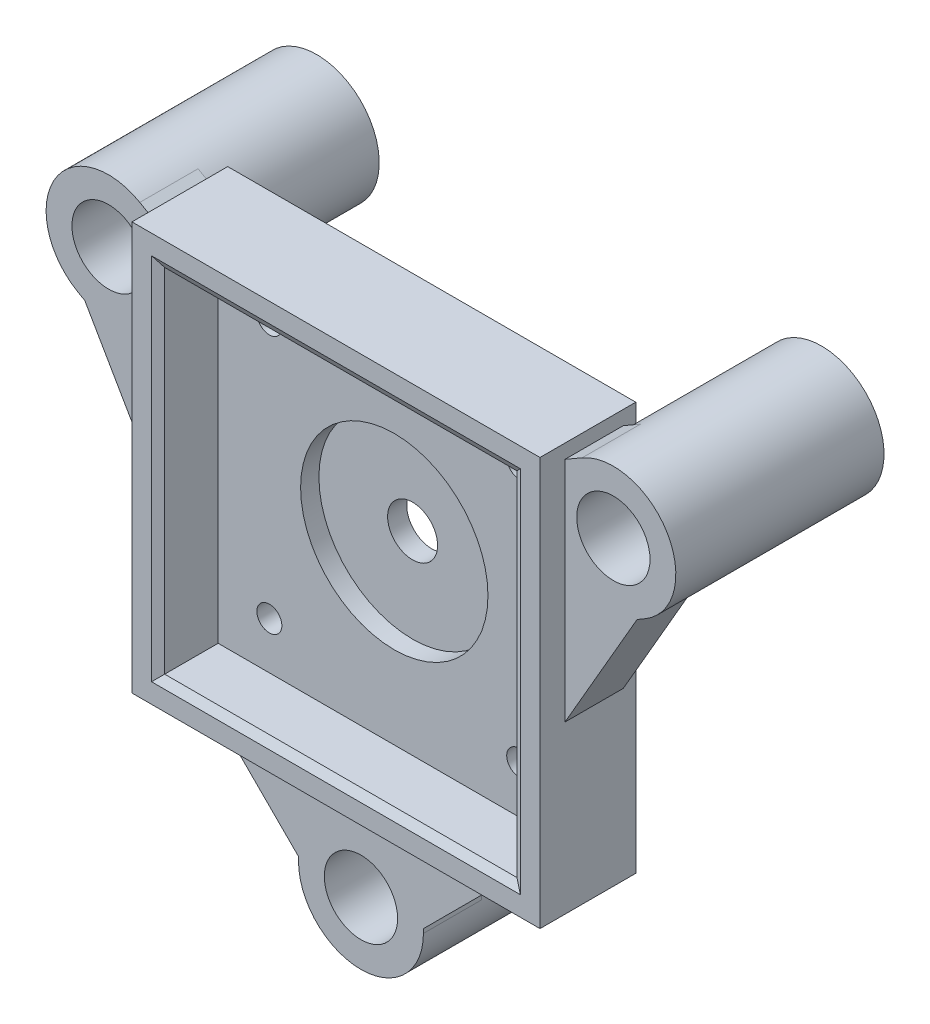
from build123d import *

# Parameters (mm, degrees)
SKIZZE1_W                             = 49
SKIZZE1_H                             = 49
AUFSATZ_LINEAR_AUSTRAGEN1_DEPTH       = 11.5
SKIZZE2_W                             = 42.3
SKIZZE2_H                             = 42.3
SCHNITT_LINEAR_AUSTRAGEN1_DEPTH       = 5
SKIZZE3_R                             = 2.85
SCHNITT_LINEAR_AUSTRAGEN2_DEPTH       = 7
AUFSATZ_LINEAR_AUSTRAGEN2_DEPTH       = 2
AUFSATZ_LINEAR_AUSTRAGEN2_DEPTH_BACK  = 5
SKIZZE6_W                             = 42.3
SKIZZE6_H                             = 42.3
SCHNITT_LINEAR_AUSTRAGEN3_DEPTH       = 7
AUFSATZ_LINEAR_START                  = 18
SKIZZE8_R                             = 7.5
AUFSATZ_LINEAR_AUSTRAGEN3_DEPTH       = 18
FASE2_SIZE                            = 10
FASE4_SIZE                            = 1
FASE4_SIZE2                           = 0.577350269
SKIZZE17_R                            = 3
SCHNITT_LINEAR_AUSTRAGEN8_DEPTH       = 23
SKIZZE18_R                            = 11.25
SCHNITT_LINEAR_AUSTRAGEN9_DEPTH       = 2.2
SCHNITT_LINEAR_AUSTRAGEN10_DEPTH      = 64.402786508
SCHNITT_LINEAR_AUSTRAGEN10_DEPTH_BACK = 64.402786508
SKIZZE10_R                            = 2.5
SKIZZE19_R                            = 4.4
SCHNITT_LINEAR_AUSTRAGEN11_DEPTH      = 12
KREISMUSTER1_COUNT                    = 3
SKIZZE21_R                            = 1.5
SCHNITT_LINEAR_AUSTRAGEN12_DEPTH      = 10
SKIZZE22_R                            = 3
SCHNITT_LINEAR_AUSTRAGEN13_DEPTH      = 2


with BuildPart() as part:
    # Skizze1 → Aufsatz-Linear austragen1 (new body)
    with BuildSketch(Plane.XY):
        Rectangle(SKIZZE1_W, SKIZZE1_H)
    extrude(amount=AUFSATZ_LINEAR_AUSTRAGEN1_DEPTH)

    # Skizze2 → Schnitt-Linear austragen1 (cut)
    with BuildSketch(Plane.XY.offset(11.5)):
        Rectangle(SKIZZE2_W, SKIZZE2_H)
    extrude(amount=-SCHNITT_LINEAR_AUSTRAGEN1_DEPTH, mode=Mode.SUBTRACT)

    # Skizze3 → Schnitt-Linear austragen2 (cut)
    with BuildSketch(Plane.XY.offset(6.5)):
        Circle(SKIZZE3_R)
    extrude(amount=-SCHNITT_LINEAR_AUSTRAGEN2_DEPTH, mode=Mode.SUBTRACT)

    # Skizze5 → Aufsatz-Linear austragen2 (add, two sides: drawn at the far end of the back side and taken through both)
    with BuildSketch(Plane.XY.offset(6.5).offset(-AUFSATZ_LINEAR_AUSTRAGEN2_DEPTH_BACK)):
        with BuildLine():
            Line((26.560889132, 23.995190528), (0, 8.660254038))
            Line((0, 8.660254038), (-26.560889132, 23.995190528))
            ThreePointArc((-26.560889132, 23.995190528), (-36.806079661, 21.25), (-34.060889132, 11.004809472))
            Line((-34.060889132, 11.004809472), (-7.5, -4.330127019))
            Line((-7.5, -4.330127019), (-7.5, -35))
            ThreePointArc((-7.5, -35), (0, -42.5), (7.5, -35))
            Line((7.5, -35), (7.5, -4.330127019))
            Line((7.5, -4.330127019), (34.060889132, 11.004809472))
            ThreePointArc((34.060889132, 11.004809472), (36.806079661, 21.25), (26.560889132, 23.995190528))
        make_face()
    extrude(amount=AUFSATZ_LINEAR_AUSTRAGEN2_DEPTH + AUFSATZ_LINEAR_AUSTRAGEN2_DEPTH_BACK)

    # Skizze6 → Schnitt-Linear austragen3 (cut)
    with BuildSketch(Plane.XY.offset(11.5)):
        Rectangle(SKIZZE6_W, SKIZZE6_H)
    extrude(amount=-SCHNITT_LINEAR_AUSTRAGEN3_DEPTH, mode=Mode.SUBTRACT)

    # Skizze8 → Aufsatz-Linear austragen3 (add)
    with BuildSketch(Plane(origin=(0, 0, 1.5), x_dir=(-1, 0, 0), z_dir=(0, 0, -1)).offset(AUFSATZ_LINEAR_START)):
        with Locations(Location((-30.310889132, 17.5, 0), (0, 0, 240))):
            Circle(SKIZZE8_R)
        with Locations((0, -35)):
            Circle(SKIZZE8_R)
        with Locations((30.310889132, 17.5)):
            Circle(SKIZZE8_R)
    extrude(amount=-AUFSATZ_LINEAR_AUSTRAGEN3_DEPTH)

    # Fase2
    fase2_edges = [part.edges().sort_by_distance(p)[0] for p in [
        (-24.5, 5.484827557, 5),
        (-7.5, -24.5, 5),
        (7.5, -24.5, 5),
        (24.5, 5.484827557, 5),
    ]]
    chamfer(fase2_edges, length=FASE2_SIZE)

    # Fase4
    fase4_edges = [part.edges().sort_by_distance(p)[0] for p in [
        (21.15, 0, 11.5),
        (0, 21.15, 11.5),
        (-21.15, 0, 11.5),
        (0, -21.15, 11.5),
    ]]
    fase4_side = [part.faces().sort_by_distance(p)[0] for p in [
        (0, 23.807035354, 11.5),
    ]]
    chamfer(fase4_edges, length=FASE4_SIZE, length2=FASE4_SIZE2, reference=fase4_side[0])

    # Skizze17 → Schnitt-Linear austragen8 (cut)
    with BuildSketch(Plane.XY.offset(4.5)):
        Circle(SKIZZE17_R)
    extrude(amount=-SCHNITT_LINEAR_AUSTRAGEN8_DEPTH, mode=Mode.SUBTRACT)

    # Skizze18 → Schnitt-Linear austragen9 (cut)
    with BuildSketch(Plane.XY.offset(4.5)):
        Circle(SKIZZE18_R)
    extrude(amount=-SCHNITT_LINEAR_AUSTRAGEN9_DEPTH, mode=Mode.SUBTRACT)

    # Skizze10 → Schnitt-Linear austragen10 (cut, two sides: drawn at the far end of the back side and taken through both)
    with BuildSketch(Plane(origin=(0, 0, -16.5), x_dir=(-1, 0, 0), z_dir=(0, 0, -1)).offset(-SCHNITT_LINEAR_AUSTRAGEN10_DEPTH_BACK)):
        with Locations((-30.310889132, 17.5)):
            Circle(SKIZZE10_R)
        with Locations((30.310889132, 17.5)):
            Circle(SKIZZE10_R)
        with Locations((0, -35)):
            Circle(SKIZZE10_R)
    extrude(amount=SCHNITT_LINEAR_AUSTRAGEN10_DEPTH + SCHNITT_LINEAR_AUSTRAGEN10_DEPTH_BACK, mode=Mode.SUBTRACT)

    # Skizze19 → Schnitt-Linear austragen11 (cut)
    with BuildSketch(Plane.XY.offset(8.5)):
        with Locations((30.310889132, 17.5)):
            Circle(SKIZZE19_R)
    schnitt_linear_austragen11 = extrude(amount=-SCHNITT_LINEAR_AUSTRAGEN11_DEPTH, mode=Mode.SUBTRACT)

    # Kreismuster1: Schnitt-Linear austragen11 ×3 about axis
    kreismuster1_axis = Axis((0, 0, 0), (0, 0, 1))
    for i in range(1, KREISMUSTER1_COUNT):
        add(schnitt_linear_austragen11.rotate(kreismuster1_axis, i * 360 / KREISMUSTER1_COUNT), mode=Mode.SUBTRACT)

    # Skizze21 → Schnitt-Linear austragen12 (cut)
    with BuildSketch(Plane.XY.offset(4.5)):
        with Locations((-15, 15.5)):
            Circle(SKIZZE21_R)
        with Locations((15, 15.5)):
            Circle(SKIZZE21_R)
        with Locations((15, -15.5)):
            Circle(SKIZZE21_R)
        with Locations((-15, -15.5)):
            Circle(SKIZZE21_R)
    extrude(amount=-SCHNITT_LINEAR_AUSTRAGEN12_DEPTH, mode=Mode.SUBTRACT)

    # Skizze22 → Schnitt-Linear austragen13 (cut)
    with BuildSketch(Plane(origin=(0, 0, 0), x_dir=(-1, 0, 0), z_dir=(0, 0, -1))):
        with Locations((-15, 15.5)):
            Circle(SKIZZE22_R)
        with Locations((15, 15.5)):
            Circle(SKIZZE22_R)
        with Locations((15, -15.5)):
            Circle(SKIZZE22_R)
        with Locations((-15, -15.5)):
            Circle(SKIZZE22_R)
    extrude(amount=-SCHNITT_LINEAR_AUSTRAGEN13_DEPTH, mode=Mode.SUBTRACT)


solid = part.part
